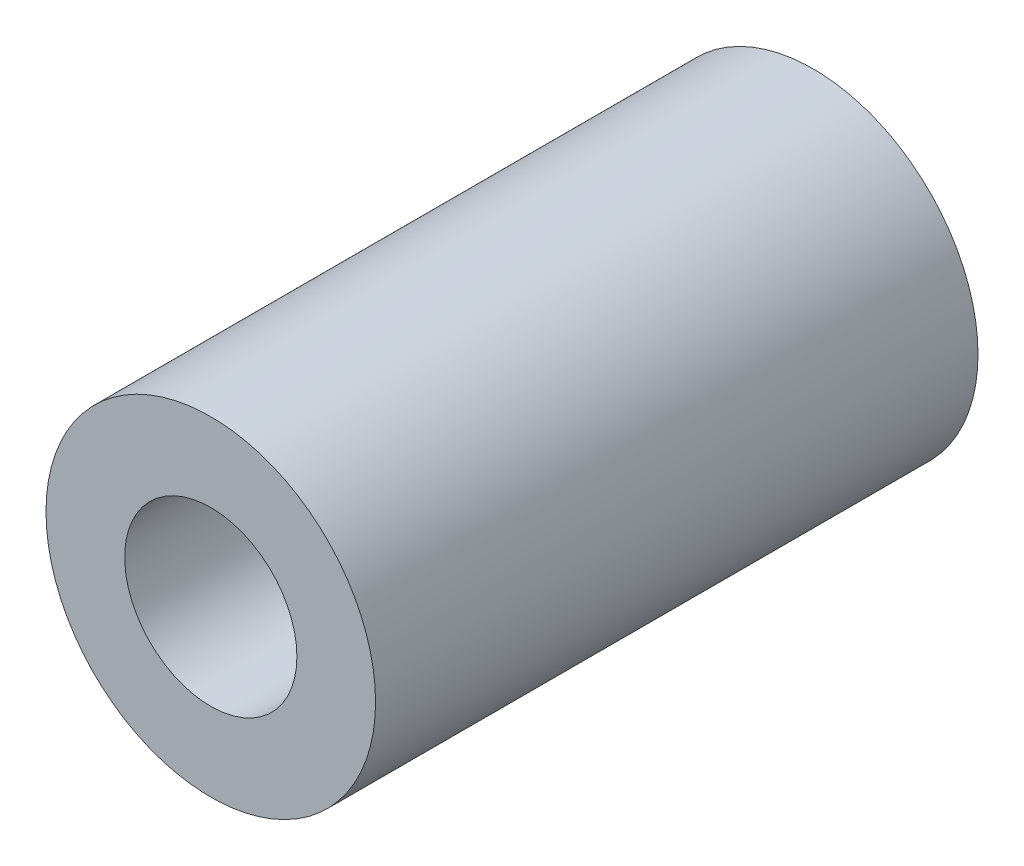
from build123d import *

# Parameters (mm, degrees)
SKETCH2_R           = 4.7625
SKETCH2_R_2         = 2.4892
BOSS_EXTRUDE1_DEPTH = 8.70585


with BuildPart() as part:
    # Sketch2 → Boss-Extrude1 (new, symmetric)
    with BuildSketch(Plane.XY):
        Circle(SKETCH2_R)
        Circle(SKETCH2_R_2, mode=Mode.SUBTRACT)
    extrude(amount=BOSS_EXTRUDE1_DEPTH, both=True)


solid = part.part
